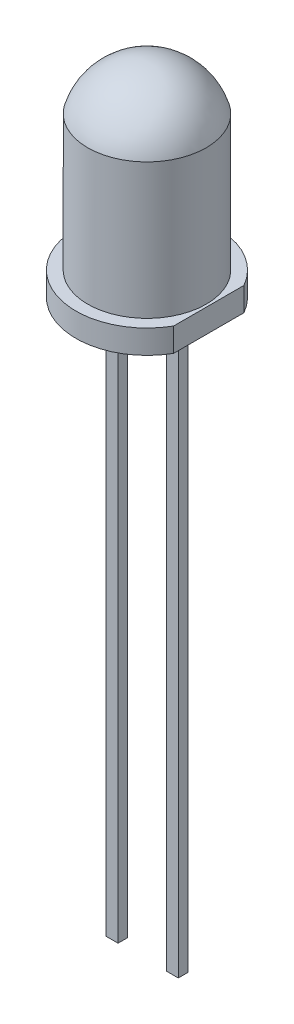
from build123d import *

# Parameters (mm, degrees)
SALIENTE_EXTRUIR2_DEPTH = 1
CROQUIS3_W              = 0.5
CROQUIS3_H              = 0.4
SALIENTE_EXTRUIR3_DEPTH = 24


with BuildPart() as part:
    # Croquis1 → Revolución1 (revolve)
    with BuildSketch(Plane.XY):
        with BuildLine():
            Line((0, 0), (2.5, 0))
            Line((2.5, 0), (2.5, 5.714142843))
            ThreePointArc((2.5, 5.714142843), (1.56576317, 7.075665121), (0, 7.6))
            Line((0, 7.6), (0, 0))
        make_face()
    revolve(axis=Axis((0, 7.6, 0), (0, -1, 0)))

    # Croquis2 → Saliente-Extruir2 (add)
    with BuildSketch(Plane.XZ):
        with BuildLine():
            Line((2.607539428, 1.483488501), (2.607539428, -1.483488501))
            ThreePointArc((2.607539428, -1.483488501), (-3, 0), (2.607539428, 1.483488501))
        make_face()
    extrude(amount=SALIENTE_EXTRUIR2_DEPTH)

    # Croquis3 → Saliente-Extruir3 (add)
    with BuildSketch(Plane.XZ.offset(1)):
        with Locations((1.27, 0)):
            Rectangle(CROQUIS3_W, CROQUIS3_H)
        with Locations((-1.27, 0)):
            Rectangle(CROQUIS3_W, CROQUIS3_H)
    extrude(amount=SALIENTE_EXTRUIR3_DEPTH)


solid = part.part
